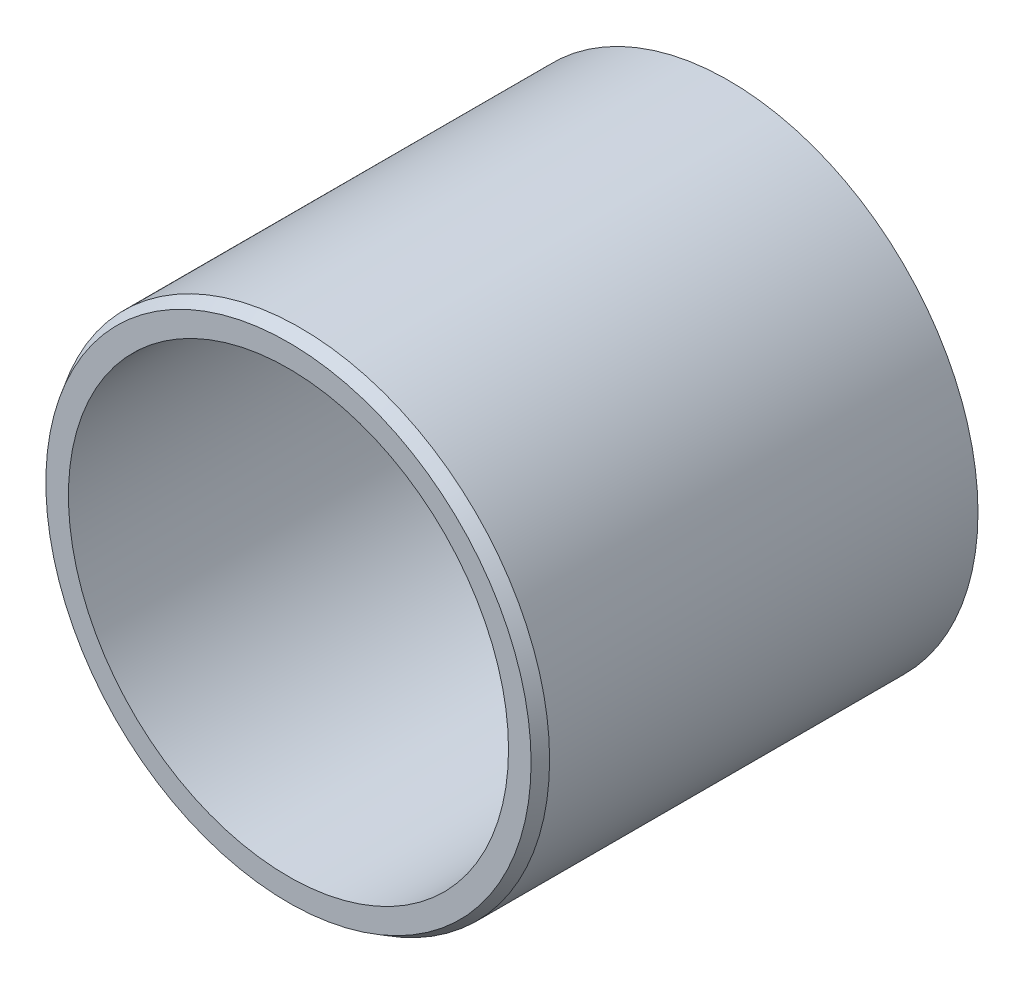
from build123d import *


with BuildPart() as part:
    # Schizzo1 → Rivoluzione1 (revolve)
    with BuildSketch(Plane(origin=(0, 0, 0), x_dir=(0, 0, -1), z_dir=(1, 0, 0)), mode=Mode.PRIVATE) as rivoluzione1_sk:
        Polygon((-14.2, 17), (15, 17), (15, 15.133974596), (14.5, 15), (-15, 15), (-15, 16.538119785), align=None)
    revolve(rivoluzione1_sk.sketch.rotate(Axis((0, 0, 16.265069321), (0, 0, -1)), 90), axis=Axis((0, 0, 16.265069321), (0, 0, -1)))


solid = part.part
